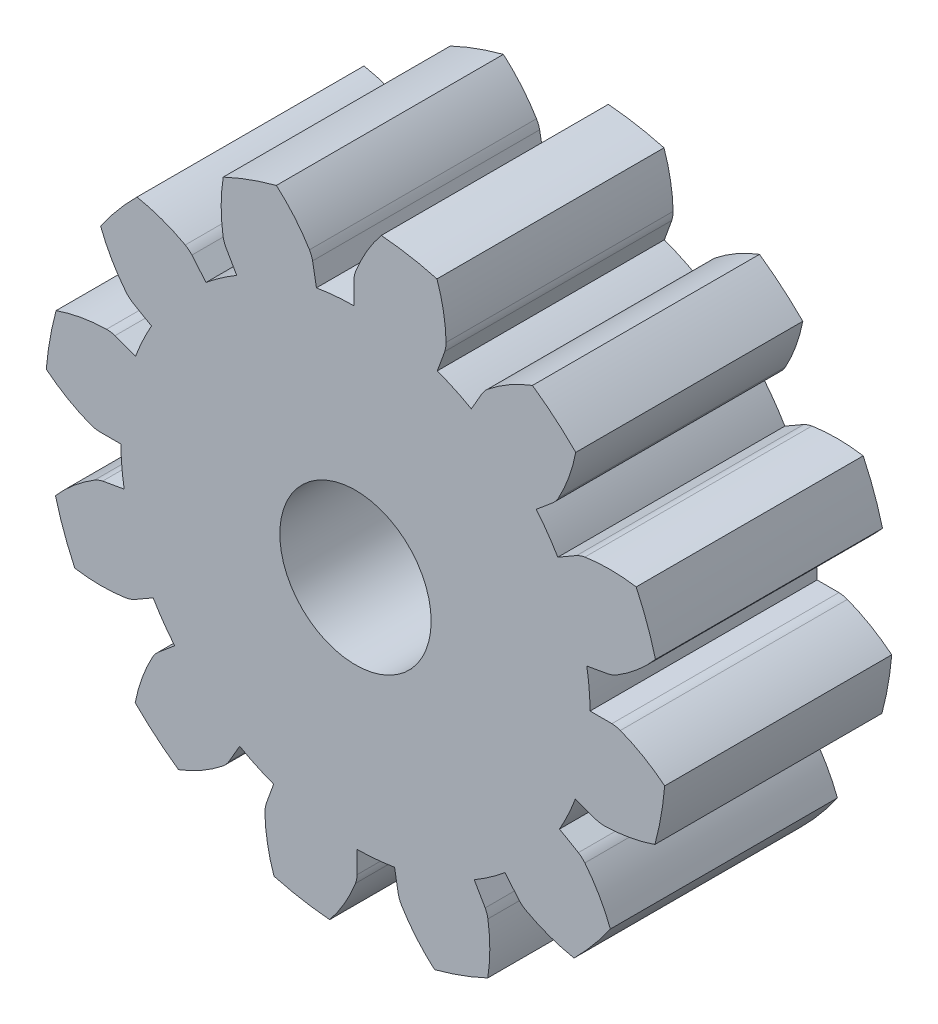
from build123d import *

# Parameters (mm, degrees)
SKETCH1_R           = 1
BOSS_EXTRUDE1_DEPTH = 1.5


with BuildPart() as part:
    # Sketch1 → Boss-Extrude1 (new, symmetric)
    with BuildSketch(Plane.XY):
        with BuildLine():
            Line((-0.022308457, 3.388443306), (-0.022308457, 3.09991973))
            ThreePointArc((-0.022308457, 3.09991973), (-0.270182803, 3.088203564), (-0.516325871, 3.056698807))
            Line((-0.516325871, 3.056698807), (-0.566427464, 3.340839061))
            ThreePointArc((-0.566427464, 3.340839061), (-0.583212597, 3.395348635), (-0.607768622, 3.446827136))
            ThreePointArc((-0.607768622, 3.446827136), (-0.806569619, 3.722605346), (-1.04548536, 3.964462178))
            ThreePointArc((-1.04548536, 3.964462178), (-1.402282588, 3.852739745), (-1.747418917, 3.708979257))
            ThreePointArc((-1.747418917, 3.708979257), (-1.774976418, 3.370134097), (-1.75, 3.031088913))
            ThreePointArc((-1.75, 3.031088913), (-1.735721264, 2.975869786), (-1.713541343, 2.923323754))
            Line((-1.713541343, 2.923323754), (-1.569279555, 2.673455008))
            ThreePointArc((-1.569279555, 2.673455008), (-1.778086953, 2.539371337), (-1.975500724, 2.389015883))
            Line((-1.975500724, 2.389015883), (-2.160960104, 2.610037765))
            ThreePointArc((-2.160960104, 2.610037765), (-2.202751242, 2.648851875), (-2.249756634, 2.681155551))
            ThreePointArc((-2.249756634, 2.681155551), (-2.559812453, 2.820585989), (-2.88764797, 2.910582279))
            ThreePointArc((-2.88764797, 2.910582279), (-3.140782217, 2.6354292), (-3.367798802, 2.3383608))
            ThreePointArc((-3.367798802, 2.3383608), (-3.222241717, 2.031133533), (-3.031088913, 1.75))
            ThreePointArc((-3.031088913, 1.75), (-2.991113602, 1.7093182), (-2.945632211, 1.674901963))
            Line((-2.945632211, 1.674901963), (-2.695763464, 1.530640175))
            ThreePointArc((-2.695763464, 1.530640175), (-2.80955414, 1.310116611), (-2.905341754, 1.081198083))
            Line((-2.905341754, 1.081198083), (-3.176465229, 1.179878957))
            ThreePointArc((-3.176465229, 1.179878957), (-3.232064471, 1.192597393), (-3.288924173, 1.197070502))
            ThreePointArc((-3.288924173, 1.197070502), (-3.627155608, 1.162792893), (-3.956067639, 1.076814208))
            ThreePointArc((-3.956067639, 1.076814208), (-4.037711787, 0.711957528), (-4.085779717, 0.341180455))
            ThreePointArc((-4.085779717, 0.341180455), (-3.806109951, 0.14789238), (-3.5, 0))
            ThreePointArc((-3.5, 0), (-3.445039465, -0.015243816), (-3.388443306, -0.022308457))
            Line((-3.388443306, -0.022308457), (-3.09991973, -0.022308457))
            ThreePointArc((-3.09991973, -0.022308457), (-3.088203564, -0.270182803), (-3.056698807, -0.516325871))
            Line((-3.056698807, -0.516325871), (-3.340839061, -0.566427464))
            ThreePointArc((-3.340839061, -0.566427464), (-3.395348635, -0.583212597), (-3.446827136, -0.607768622))
            ThreePointArc((-3.446827136, -0.607768622), (-3.722605346, -0.806569619), (-3.964462178, -1.04548536))
            ThreePointArc((-3.964462178, -1.04548536), (-3.852739745, -1.402282588), (-3.708979257, -1.747418917))
            ThreePointArc((-3.708979257, -1.747418917), (-3.370134097, -1.774976418), (-3.031088913, -1.75))
            ThreePointArc((-3.031088913, -1.75), (-2.975869786, -1.735721264), (-2.923323754, -1.713541343))
            Line((-2.923323754, -1.713541343), (-2.673455008, -1.569279555))
            ThreePointArc((-2.673455008, -1.569279555), (-2.539371337, -1.778086953), (-2.389015883, -1.975500724))
            Line((-2.389015883, -1.975500724), (-2.610037765, -2.160960104))
            ThreePointArc((-2.610037765, -2.160960104), (-2.648851875, -2.202751242), (-2.681155551, -2.249756634))
            ThreePointArc((-2.681155551, -2.249756634), (-2.820585989, -2.559812453), (-2.910582279, -2.88764797))
            ThreePointArc((-2.910582279, -2.88764797), (-2.6354292, -3.140782217), (-2.3383608, -3.367798802))
            ThreePointArc((-2.3383608, -3.367798802), (-2.031133533, -3.222241717), (-1.75, -3.031088913))
            ThreePointArc((-1.75, -3.031088913), (-1.7093182, -2.991113602), (-1.674901963, -2.945632211))
            Line((-1.674901963, -2.945632211), (-1.530640175, -2.695763464))
            ThreePointArc((-1.530640175, -2.695763464), (-1.310116611, -2.80955414), (-1.081198083, -2.905341754))
            Line((-1.081198083, -2.905341754), (-1.179878957, -3.176465229))
            ThreePointArc((-1.179878957, -3.176465229), (-1.192597393, -3.232064471), (-1.197070502, -3.288924173))
            ThreePointArc((-1.197070502, -3.288924173), (-1.162792893, -3.627155608), (-1.076814208, -3.956067639))
            ThreePointArc((-1.076814208, -3.956067639), (-0.711957528, -4.037711787), (-0.341180455, -4.085779717))
            ThreePointArc((-0.341180455, -4.085779717), (-0.14789238, -3.806109951), (0, -3.5))
            ThreePointArc((0, -3.5), (0.015243816, -3.445039465), (0.022308457, -3.388443306))
            Line((0.022308457, -3.388443306), (0.022308457, -3.09991973))
            ThreePointArc((0.022308457, -3.09991973), (0.270182803, -3.088203564), (0.516325871, -3.056698807))
            Line((0.516325871, -3.056698807), (0.566427464, -3.340839061))
            ThreePointArc((0.566427464, -3.340839061), (0.583212597, -3.395348635), (0.607768622, -3.446827136))
            ThreePointArc((0.607768622, -3.446827136), (0.806569619, -3.722605346), (1.04548536, -3.964462178))
            ThreePointArc((1.04548536, -3.964462178), (1.402282588, -3.852739745), (1.747418917, -3.708979257))
            ThreePointArc((1.747418917, -3.708979257), (1.774976418, -3.370134097), (1.75, -3.031088913))
            ThreePointArc((1.75, -3.031088913), (1.735721264, -2.975869786), (1.713541343, -2.923323754))
            Line((1.713541343, -2.923323754), (1.569279555, -2.673455008))
            ThreePointArc((1.569279555, -2.673455008), (1.778086953, -2.539371337), (1.975500724, -2.389015883))
            Line((1.975500724, -2.389015883), (2.160960104, -2.610037765))
            ThreePointArc((2.160960104, -2.610037765), (2.202751242, -2.648851875), (2.249756634, -2.681155551))
            ThreePointArc((2.249756634, -2.681155551), (2.559812453, -2.820585989), (2.88764797, -2.910582279))
            ThreePointArc((2.88764797, -2.910582279), (3.140782217, -2.6354292), (3.367798802, -2.3383608))
            ThreePointArc((3.367798802, -2.3383608), (3.222241717, -2.031133533), (3.031088913, -1.75))
            ThreePointArc((3.031088913, -1.75), (2.991113602, -1.7093182), (2.945632211, -1.674901963))
            Line((2.945632211, -1.674901963), (2.695763464, -1.530640175))
            ThreePointArc((2.695763464, -1.530640175), (2.80955414, -1.310116611), (2.905341754, -1.081198083))
            Line((2.905341754, -1.081198083), (3.176465229, -1.179878957))
            ThreePointArc((3.176465229, -1.179878957), (3.232064471, -1.192597393), (3.288924173, -1.197070502))
            ThreePointArc((3.288924173, -1.197070502), (3.627155608, -1.162792893), (3.956067639, -1.076814208))
            ThreePointArc((3.956067639, -1.076814208), (4.037711787, -0.711957528), (4.085779717, -0.341180455))
            ThreePointArc((4.085779717, -0.341180455), (3.806109951, -0.14789238), (3.5, 0))
            ThreePointArc((3.5, 0), (3.445039465, 0.015243816), (3.388443306, 0.022308457))
            Line((3.388443306, 0.022308457), (3.09991973, 0.022308457))
            ThreePointArc((3.09991973, 0.022308457), (3.088203564, 0.270182803), (3.056698807, 0.516325871))
            Line((3.056698807, 0.516325871), (3.340839061, 0.566427464))
            ThreePointArc((3.340839061, 0.566427464), (3.395348635, 0.583212597), (3.446827136, 0.607768622))
            ThreePointArc((3.446827136, 0.607768622), (3.722605346, 0.806569619), (3.964462178, 1.04548536))
            ThreePointArc((3.964462178, 1.04548536), (3.852739745, 1.402282588), (3.708979257, 1.747418917))
            ThreePointArc((3.708979257, 1.747418917), (3.370134097, 1.774976418), (3.031088913, 1.75))
            ThreePointArc((3.031088913, 1.75), (2.975869786, 1.735721264), (2.923323754, 1.713541343))
            Line((2.923323754, 1.713541343), (2.673455008, 1.569279555))
            ThreePointArc((2.673455008, 1.569279555), (2.539371337, 1.778086953), (2.389015883, 1.975500724))
            Line((2.389015883, 1.975500724), (2.610037765, 2.160960104))
            ThreePointArc((2.610037765, 2.160960104), (2.648851875, 2.202751242), (2.681155551, 2.249756634))
            ThreePointArc((2.681155551, 2.249756634), (2.820585989, 2.559812453), (2.910582279, 2.88764797))
            ThreePointArc((2.910582279, 2.88764797), (2.6354292, 3.140782217), (2.3383608, 3.367798802))
            ThreePointArc((2.3383608, 3.367798802), (2.031133533, 3.222241717), (1.75, 3.031088913))
            ThreePointArc((1.75, 3.031088913), (1.7093182, 2.991113602), (1.674901963, 2.945632211))
            Line((1.674901963, 2.945632211), (1.530640175, 2.695763464))
            ThreePointArc((1.530640175, 2.695763464), (1.310116611, 2.80955414), (1.081198083, 2.905341754))
            Line((1.081198083, 2.905341754), (1.179878957, 3.176465229))
            ThreePointArc((1.179878957, 3.176465229), (1.192597393, 3.232064471), (1.197070502, 3.288924173))
            ThreePointArc((1.197070502, 3.288924173), (1.162792893, 3.627155608), (1.076814208, 3.956067639))
            ThreePointArc((1.076814208, 3.956067639), (0.711957528, 4.037711787), (0.341180455, 4.085779717))
            ThreePointArc((0.341180455, 4.085779717), (0.14789238, 3.806109951), (0, 3.5))
            ThreePointArc((0, 3.5), (-0.015243816, 3.445039465), (-0.022308457, 3.388443306))
        make_face()
        Circle(SKETCH1_R, mode=Mode.SUBTRACT)
    extrude(amount=BOSS_EXTRUDE1_DEPTH, both=True)


solid = part.part
